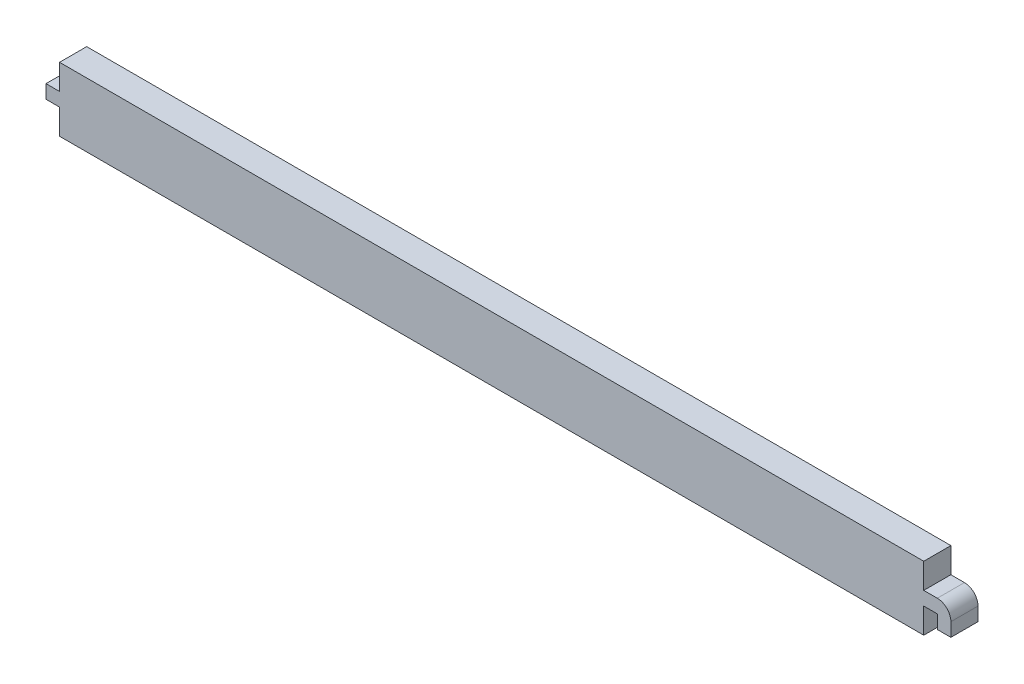
from build123d import *

# Parameters (mm, degrees)
SKETCH1_W           = 202.3
SKETCH1_H           = 15
BOSS_EXTRUDE1_DEPTH = 6.35
BOSS_EXTRUDE2_DEPTH = 6.35


with BuildPart() as part:
    # Sketch1 → Boss-Extrude1 (new body)
    with BuildSketch(Plane.XY):
        with Locations((101.15, 7.5)):
            Rectangle(SKETCH1_W, SKETCH1_H)
    extrude(amount=BOSS_EXTRUDE1_DEPTH)

    # Sketch2 → Boss-Extrude2 (add)
    with BuildSketch(Plane.XY.offset(6.35)):
        with BuildLine():
            Line((208.65, 5.9125), (208.65, 2.7375))
            Line((208.65, 2.7375), (205.475, 2.7375))
            Line((205.475, 2.7375), (205.475, 5.9125))
            Line((205.475, 5.9125), (202.3, 5.9125))
            Line((202.3, 5.9125), (202.3, 7.5))
            Line((202.3, 7.5), (202.3, 9.0875))
            Line((202.3, 9.0875), (205.475, 9.0875))
            ThreePointArc((205.475, 9.0875), (207.72006403, 8.15756403), (208.65, 5.9125))
        make_face()
        Polygon((0, 7.5), (0, 9.0875), (-3.175, 9.0875), (-3.175, 5.9125), (0, 5.9125), align=None)
    extrude(amount=-BOSS_EXTRUDE2_DEPTH)


solid = part.part
